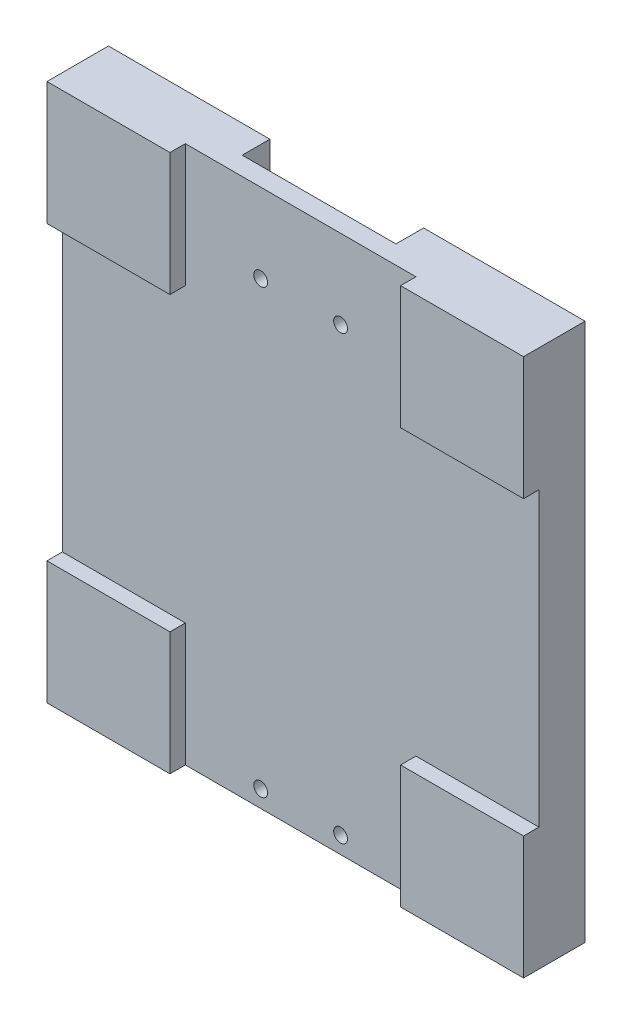
from build123d import *

# Parameters (mm, degrees)
SKETCH_1_W                  = 310
SKETCH_1_H                  = 350
EXTRUDE_1_DEPTH             = 30
SKETCH_2_W                  = 100
SKETCH_2_H                  = 18
CUT_EXTRUDE_1_DEPTH         = 384.959633295
SKETCH_3_W                  = 80
SKETCH_3_H                  = 80
EXTRUDE_2_DEPTH             = 10
SKETCH_5_W                  = 71
SKETCH_5_H                  = 4
CUT_EXTRUDE_3_DEPTH         = 21
SKETCH_7_W                  = 71
SKETCH_7_H                  = 25
CUT_EXTRUDE_4_DEPTH         = 4
SKETCH_8_R                  = 4.5
CUT_EXTRUDE_5_DEPTH         = 235.806303152
HOLE_WIZARD_M6_1_D          = 5
HOLE_WIZARD_M6_1_DEPTH      = 12
HOLE_WIZARD_M6_1_TIP        = 1.502151548
HOLE_WIZARD_M4_1_AT_2_COUNT = 2
HOLE_WIZARD_M4_1_AT_2_PITCH = 165
PATTERN_LINEAR_1_COUNT      = 6
PATTERN_LINEAR_1_PITCH      = 60


with BuildPart() as part:
    # 草图1 → 凸台-拉伸1 (new body)
    with BuildSketch(Plane.XY):
        Rectangle(SKETCH_1_W, SKETCH_1_H)
    extrude(amount=EXTRUDE_1_DEPTH)

    # 草图2 → 切除-拉伸1 (cut, through all)
    with BuildSketch(Plane(origin=(0, 175, 0), x_dir=(1, 0, 0), z_dir=(0, 1, 0))):
        with Locations((0, -9)):
            Rectangle(SKETCH_2_W, SKETCH_2_H)
    extrude(amount=-CUT_EXTRUDE_1_DEPTH, mode=Mode.SUBTRACT)

    # 草图3 → 凸台-拉伸2 (add)
    with BuildSketch(Plane.XY.offset(30)):
        with Locations((-115, 135)):
            Rectangle(SKETCH_3_W, SKETCH_3_H)
        with Locations((115, 135)):
            Rectangle(SKETCH_3_W, SKETCH_3_H)
        with Locations((-115, -135)):
            Rectangle(SKETCH_3_W, SKETCH_3_H)
        with Locations((115, -135)):
            Rectangle(SKETCH_3_W, SKETCH_3_H)
    extrude(amount=EXTRUDE_2_DEPTH)

    # 草图5 → 切除-拉伸3 (cut)
    with BuildSketch(Plane.XZ.offset(175)):
        with Locations((0, 20)):
            Rectangle(SKETCH_5_W, SKETCH_5_H)
    extrude(amount=-CUT_EXTRUDE_3_DEPTH, mode=Mode.SUBTRACT)

    # 草图7 → 切除-拉伸4 (cut)
    with BuildSketch(Plane(origin=(0, 0, 18), x_dir=(-1, 0, 0), z_dir=(0, 0, -1))):
        with Locations((0, 123)):
            Rectangle(SKETCH_7_W, SKETCH_7_H)
    extrude(amount=-CUT_EXTRUDE_4_DEPTH, mode=Mode.SUBTRACT)

    # 草图8 → 切除-拉伸5 (cut, through all)
    with BuildSketch(Plane(origin=(0, 0, 18), x_dir=(-1, 0, 0), z_dir=(0, 0, -1))):
        with Locations((-26, 123.5)):
            Circle(SKETCH_8_R)
        with Locations((26, 123.5)):
            Circle(SKETCH_8_R)
        with Locations((-26, -164)):
            Circle(SKETCH_8_R)
        with Locations((26, -164)):
            Circle(SKETCH_8_R)
    extrude(amount=-CUT_EXTRUDE_5_DEPTH, mode=Mode.SUBTRACT)

    # M6 螺纹孔1
    with Locations(Plane(origin=(147, 144, 0), x_dir=(-1, 0, 0), z_dir=(0, 0, -1))):
        with Locations((0, 0), (46, 0), (248, 0), (294, 0), (0, -288), (46, -288), (248, -288), (294, -288)):
            Hole(HOLE_WIZARD_M6_1_D / 2, depth=HOLE_WIZARD_M6_1_DEPTH)
            with Locations((0, 0, -(HOLE_WIZARD_M6_1_DEPTH + HOLE_WIZARD_M6_1_TIP / 2))):  # 118° drill point
                Cone(0, HOLE_WIZARD_M6_1_D / 2, HOLE_WIZARD_M6_1_TIP, mode=Mode.SUBTRACT)

    # 草图14 → M4 螺纹孔1 (revolve, cut)
    with BuildSketch(Plane(origin=(82.5, 150, 0), x_dir=(0, 1, 0), z_dir=(1, 0, 0))):
        Polygon((0, 0), (0, 10.991420021), (1.65, 10), (1.65, 0), align=None)
    hole_wizard_m4_1 = revolve(axis=Axis((82.5, 150, -6.35), (0, 0, 1)), mode=Mode.SUBTRACT)

    # M4 螺纹孔1 at 2: M4 螺纹孔1 ×2
    with Locations(*[(-i * HOLE_WIZARD_M4_1_AT_2_PITCH, 0, 0) for i in range(1, HOLE_WIZARD_M4_1_AT_2_COUNT)]):
        add(hole_wizard_m4_1, mode=Mode.SUBTRACT)

    # 阵列(线性)1: M4 螺纹孔1 ×6
    with Locations(*[(0, -i * PATTERN_LINEAR_1_PITCH, 0) for i in range(1, PATTERN_LINEAR_1_COUNT)]):
        add(hole_wizard_m4_1, mode=Mode.SUBTRACT)

    # 阵列(线性)1 copy 1 sketch → 阵列(线性)1 copy 1 (revolve, cut)
    with BuildSketch(Plane(origin=(-82.5, 90, 0), x_dir=(0, 1, 0), z_dir=(1, 0, 0))):
        Polygon((0, 0), (0, 10.991420021), (1.65, 10), (1.65, 0), align=None)
    revolve(axis=Axis((-82.5, 90, -6.35), (0, 0, 1)), mode=Mode.SUBTRACT)

    # 阵列(线性)1 copy 2 sketch → 阵列(线性)1 copy 2 (revolve, cut)
    with BuildSketch(Plane(origin=(-82.5, 30, 0), x_dir=(0, 1, 0), z_dir=(1, 0, 0))):
        Polygon((0, 0), (0, 10.991420021), (1.65, 10), (1.65, 0), align=None)
    revolve(axis=Axis((-82.5, 30, -6.35), (0, 0, 1)), mode=Mode.SUBTRACT)

    # 阵列(线性)1 copy 3 sketch → 阵列(线性)1 copy 3 (revolve, cut)
    with BuildSketch(Plane(origin=(-82.5, -30, 0), x_dir=(0, 1, 0), z_dir=(1, 0, 0))):
        Polygon((0, 0), (0, 10.991420021), (1.65, 10), (1.65, 0), align=None)
    revolve(axis=Axis((-82.5, -30, -6.35), (0, 0, 1)), mode=Mode.SUBTRACT)

    # 阵列(线性)1 copy 4 sketch → 阵列(线性)1 copy 4 (revolve, cut)
    with BuildSketch(Plane(origin=(-82.5, -90, 0), x_dir=(0, 1, 0), z_dir=(1, 0, 0))):
        Polygon((0, 0), (0, 10.991420021), (1.65, 10), (1.65, 0), align=None)
    revolve(axis=Axis((-82.5, -90, -6.35), (0, 0, 1)), mode=Mode.SUBTRACT)

    # 阵列(线性)1 copy 5 sketch → 阵列(线性)1 copy 5 (revolve, cut)
    with BuildSketch(Plane(origin=(-82.5, -150, 0), x_dir=(0, 1, 0), z_dir=(1, 0, 0))):
        Polygon((0, 0), (0, 10.991420021), (1.65, 10), (1.65, 0), align=None)
    revolve(axis=Axis((-82.5, -150, -6.35), (0, 0, 1)), mode=Mode.SUBTRACT)


solid = part.part
